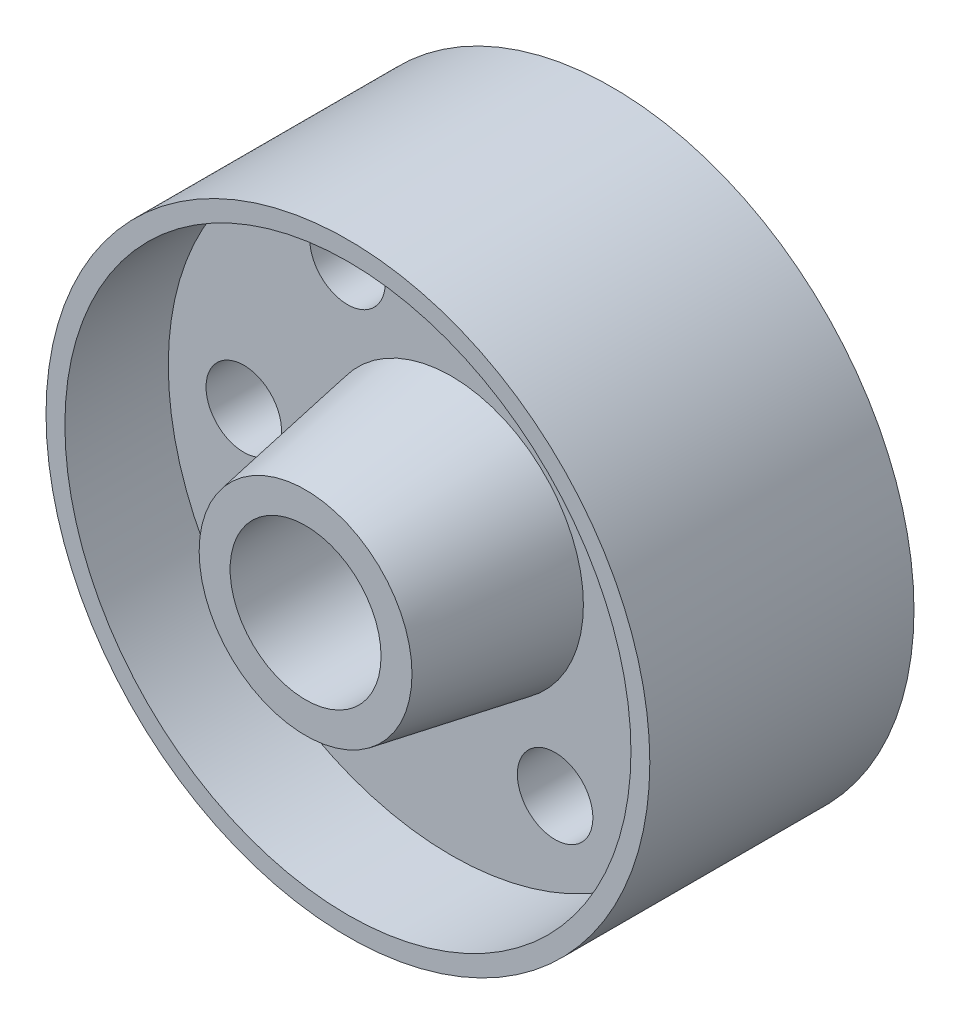
from build123d import *

# Parameters (mm, degrees)
F_3_8_0_5_DIAMETER_HOLE1_D = 12.7
CIRPATTERN1_COUNT          = 6


with BuildPart() as part:
    # Sketch1 → Revolve1 (revolve)
    with BuildSketch(Plane(origin=(0, 0, 0), x_dir=(0, 0, -1), z_dir=(1, 0, 0)), mode=Mode.PRIVATE) as revolve1_sk:
        Polygon((-29.3497, 12.7), (29.3497, 12.7), (29.3497, 17.907), (4.826, 22.225), (4.826, 47.625), (22.225, 47.625), (22.225, 50.8), (-22.225, 50.8), (-22.225, 47.625), (-4.826, 47.625), (-4.826, 22.225), (-29.3497, 17.907), align=None)
    revolve(revolve1_sk.sketch.rotate(Axis((0, 0, 50.332885059), (0, 0, -1)), 90), axis=Axis((0, 0, 50.332885059), (0, 0, -1)))

    # 3/8 (0.5) Diameter Hole1 (through all)
    with Locations(Plane.XY.offset(4.826)):
        with Locations((34.925, 0)):
            f_3_8_0_5_diameter_hole1 = Hole(F_3_8_0_5_DIAMETER_HOLE1_D / 2)

    # CirPattern1: 3/8 (0.5) Diameter Hole1 ×6 about axis
    cirpattern1_axis = Axis((0, 0, 0), (0, 0, 1))
    for i in range(1, CIRPATTERN1_COUNT):
        add(f_3_8_0_5_diameter_hole1.rotate(cirpattern1_axis, i * 360 / CIRPATTERN1_COUNT), mode=Mode.SUBTRACT)


solid = part.part
